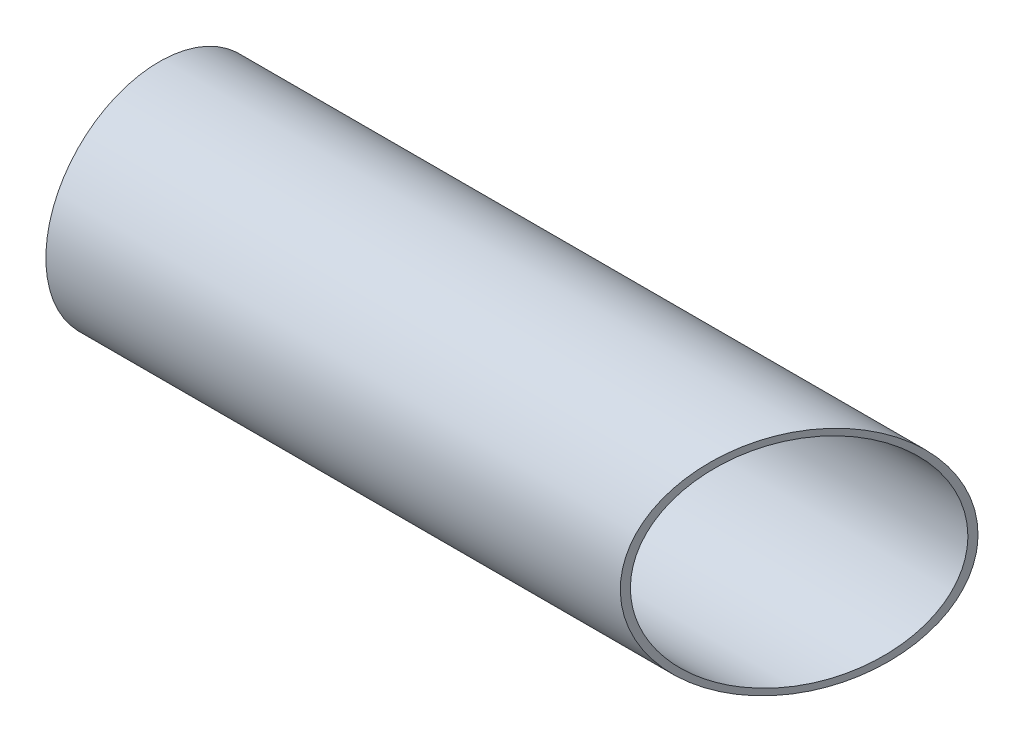
from build123d import *

# Parameters (mm, degrees)
SKETCH3_R              = 53
SKETCH3_R_2            = 50
SPLIT1_SURFACE_1_BACK  = 2303.894
SPLIT1_SURFACE_1_DEPTH = 4607.788


with BuildPart() as part:
    # Sweep1: sweep along a path in Sketch2
    with BuildLine(Plane(origin=(0, 0, 0), x_dir=(1, 0, 0), z_dir=(0, 1, 0))) as sweep1_path:
        Line((-404.145188433, -700), (404.145188433, -700))
        Line((404.145188433, -700), (808.290376865, 0))
        Line((808.290376865, 0), (404.145188433, 700))
        Line((404.145188433, 700), (-404.145188433, 700))
        Line((-404.145188433, 700), (-808.290376865, 0))
        Line((-808.290376865, 0), (-404.145188433, -700))
    # Sketch3 → Sweep1 (sweep)
    with BuildSketch(Plane(origin=(0, 0, 0), x_dir=(0, 0, -1), z_dir=(1, 0, 0))):
        with Locations((-700, 0)):
            Circle(SKETCH3_R)
        with Locations((-700, 0)):
            Circle(SKETCH3_R_2, mode=Mode.SUBTRACT)
    sweep(path=sweep1_path.line, transition=Transition.RIGHT)

    # Split1: cut with a surface, the side behind it stays
    # Split1 surface: a surface, the sketch's curves swept straight by 4607.788 mm
    with BuildLine(Plane(origin=(0, 0, 0), x_dir=(1, 0, 0), z_dir=(0, 1, 0)).offset(-SPLIT1_SURFACE_1_BACK), mode=Mode.PRIVATE) as split1_surface_1_path:
        Line((487.5, 844.37476869), (105.045188433, 181.943603456))
        Line((105.045188433, 181.943603456), (105.045188433, 969.324769304))
    split1_surface_1 = Shell.extrude(split1_surface_1_path.wire(), (0 * SPLIT1_SURFACE_1_DEPTH, 1 * SPLIT1_SURFACE_1_DEPTH, 0 * SPLIT1_SURFACE_1_DEPTH))
    split(bisect_by=split1_surface_1, keep=Keep.BOTTOM)


solid = part.part
